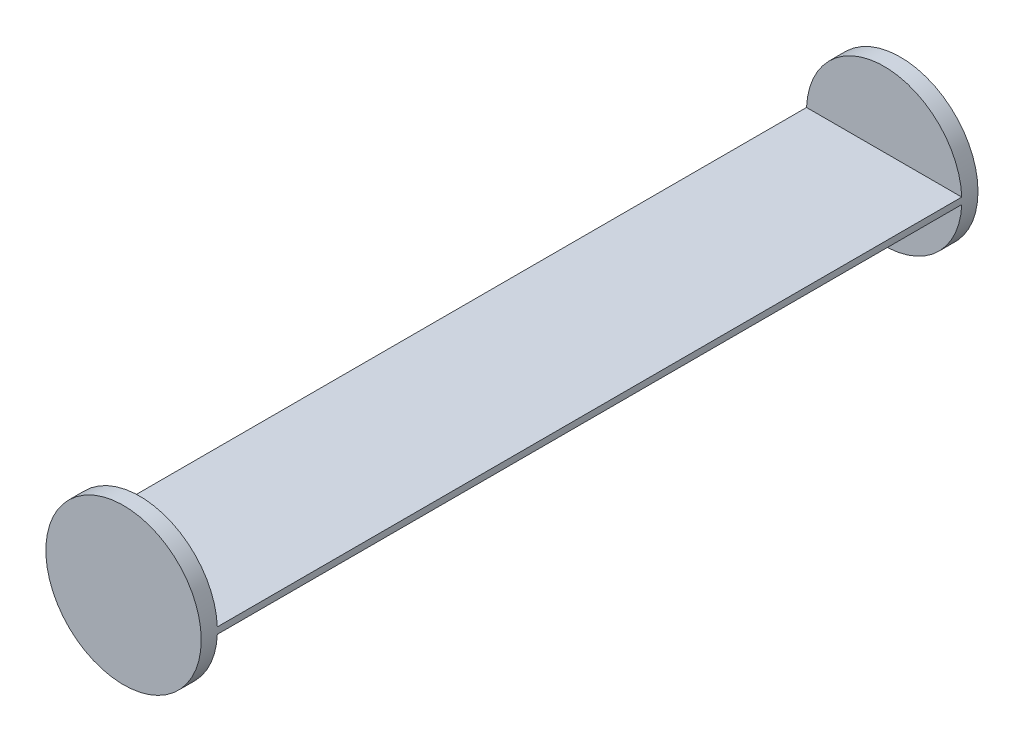
from build123d import *

# Parameters (mm, degrees)
BOSS_EXTRU_2_DEPTH      = 120
BOSS_EXTRU_2_DEPTH_BACK = 120
ESQUISSE1_R             = 24
ESQUISSE2_W             = 230
ESQUISSE2_H             = 23
ENL_V_MAT_EXTRU_1_DEPTH = 125.707658145


with BuildPart() as part:
    # Esquisse1 → Boss.-Extru.2 (new, two sides: drawn at the far end of the back side and taken through both)
    with BuildSketch(Plane.XY.offset(-BOSS_EXTRU_2_DEPTH_BACK)):
        Circle(ESQUISSE1_R)
    extrude(amount=BOSS_EXTRU_2_DEPTH + BOSS_EXTRU_2_DEPTH_BACK)

    # Esquisse2 → Enlèv. mat.-Extru.1 (cut, symmetric)
    with BuildSketch(Plane(origin=(0, 0, 0), x_dir=(0, 0, -1), z_dir=(1, 0, 0))):
        with Locations((0, 12.5)):
            Rectangle(ESQUISSE2_W, ESQUISSE2_H)
    enl_v_mat_extru_1 = extrude(amount=ENL_V_MAT_EXTRU_1_DEPTH, both=True, mode=Mode.SUBTRACT)

    # Symétrie1: Enlèv. mat.-Extru.1 across plane
    add(enl_v_mat_extru_1.mirror(Plane.ZX), mode=Mode.SUBTRACT)


solid = part.part
